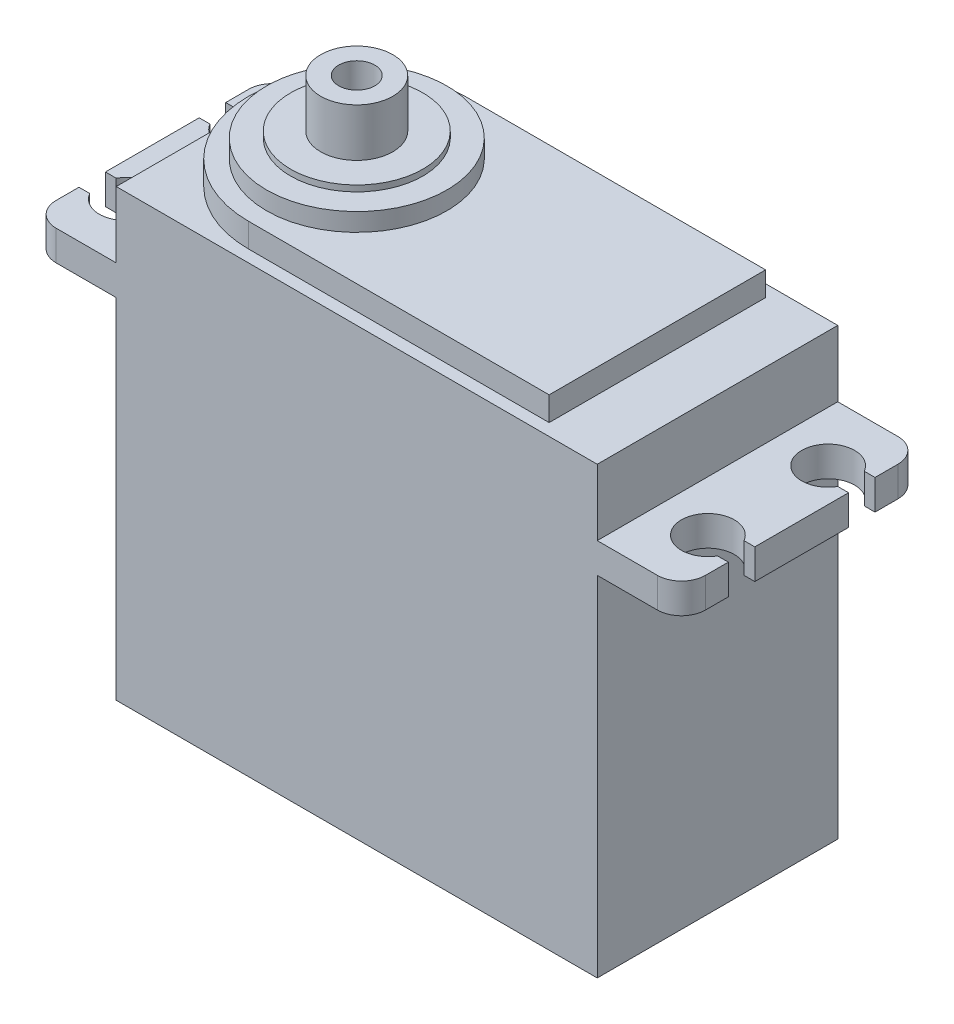
from build123d import *

# Parameters (mm, degrees)
SKETCH_1_W          = 40
SKETCH_1_H          = 20
EXTRUDE_1_DEPTH     = 37
SKETCH_2_W          = 54
SKETCH_2_H          = 20
EXTRUDE_2_DEPTH     = 2.5
SKETCH_3_R          = 2.2
CUT_EXTRUDE_1_DEPTH = 2.5
SKETCH_5_W          = 1.5
SKETCH_5_H          = 2.2
CUT_EXTRUDE_2_DEPTH = 2.5
FILLET_1_R          = 2
EXTRUDE_3_DEPTH     = 2
SKETCH_7_R          = 7.5
EXTRUDE_4_DEPTH     = 1.5
SKETCH_8_R          = 5.5
EXTRUDE_5_DEPTH     = 0.5
SKETCH_9_R          = 3
EXTRUDE_6_DEPTH     = 4
SKETCH_10_R         = 1.5
CUT_EXTRUDE_3_DEPTH = 5


with BuildPart() as part:
    # 草图1 → 凸台-拉伸1 (new body)
    with BuildSketch(Plane(origin=(0, 0, 0), x_dir=(1, 0, 0), z_dir=(0, 1, 0))):
        Rectangle(SKETCH_1_W, SKETCH_1_H)
    extrude(amount=EXTRUDE_1_DEPTH)

    # 草图2 → 凸台-拉伸2 (add)
    with BuildSketch(Plane(origin=(0, 29, 0), x_dir=(-1, 0, 0), z_dir=(0, -1, 0))):
        Rectangle(SKETCH_2_W, SKETCH_2_H)
    extrude(amount=-EXTRUDE_2_DEPTH)

    # 草图3 → 切除-拉伸1 (cut)
    with BuildSketch(Plane(origin=(0, 29, 0), x_dir=(-1, 0, 0), z_dir=(0, -1, 0))):
        with Locations(Location((24.2, 5, 0), (0, 0, 90))):
            Circle(SKETCH_3_R)
        with Locations(Location((-24.2, 5, 0), (0, 0, 90))):
            Circle(SKETCH_3_R)
        with Locations(Location((24.2, -5, 0), (0, 0, 90))):
            Circle(SKETCH_3_R)
        with Locations(Location((-24.2, -5, 0), (0, 0, 90))):
            Circle(SKETCH_3_R)
    extrude(amount=-CUT_EXTRUDE_1_DEPTH, mode=Mode.SUBTRACT)

    # 草图5 → 切除-拉伸2 (cut)
    with BuildSketch(Plane(origin=(0, 29, 0), x_dir=(-1, 0, 0), z_dir=(0, -1, 0))):
        with Locations((-26.25, 5)):
            Rectangle(SKETCH_5_W, SKETCH_5_H)
        with Locations((26.25, 5)):
            Rectangle(SKETCH_5_W, SKETCH_5_H)
        with Locations((26.25, -5)):
            Rectangle(SKETCH_5_W, SKETCH_5_H)
        with Locations((-26.25, -5)):
            Rectangle(SKETCH_5_W, SKETCH_5_H)
    extrude(amount=-CUT_EXTRUDE_2_DEPTH, mode=Mode.SUBTRACT)

    # 圆角1
    fillet_1_edges = [part.edges().sort_by_distance(p)[0] for p in [
        (27, 30.25, -10),
        (-27, 30.25, 10),
        (27, 30.25, 10),
        (-27, 30.25, -10),
    ]]
    fillet(fillet_1_edges, radius=FILLET_1_R)

    # 草图6 → 凸台-拉伸3 (add)
    with BuildSketch(Plane(origin=(0, 37, 0), x_dir=(1, 0, 0), z_dir=(0, 1, 0))):
        with BuildLine():
            Line((-10, 9), (15, 9))
            Line((15, 9), (15, -9))
            Line((15, -9), (-10, -9))
            ThreePointArc((-10, -9), (-19, 0), (-10, 9))
        make_face()
    extrude(amount=EXTRUDE_3_DEPTH)

    # 草图7 → 凸台-拉伸4 (add)
    with BuildSketch(Plane(origin=(0, 39, 0), x_dir=(1, 0, 0), z_dir=(0, 1, 0))):
        with Locations(Location((-10, 0, 0), (0, 0, 270))):
            Circle(SKETCH_7_R)
    extrude(amount=EXTRUDE_4_DEPTH)

    # 草图8 → 凸台-拉伸5 (add)
    with BuildSketch(Plane(origin=(0, 40.5, 0), x_dir=(1, 0, 0), z_dir=(0, 1, 0))):
        with Locations(Location((-10, 0, 0), (0, 0, 270))):
            Circle(SKETCH_8_R)
    extrude(amount=EXTRUDE_5_DEPTH)

    # 草图9 → 凸台-拉伸6 (add)
    with BuildSketch(Plane(origin=(0, 41, 0), x_dir=(1, 0, 0), z_dir=(0, 1, 0))):
        with Locations(Location((-10, 0, 0), (0, 0, 270))):
            Circle(SKETCH_9_R)
    extrude(amount=EXTRUDE_6_DEPTH)

    # 草图10 → 切除-拉伸3 (cut)
    with BuildSketch(Plane(origin=(0, 45, 0), x_dir=(1, 0, 0), z_dir=(0, 1, 0))):
        with Locations(Location((-10, 0, 0), (0, 0, 270))):
            Circle(SKETCH_10_R)
    extrude(amount=-CUT_EXTRUDE_3_DEPTH, mode=Mode.SUBTRACT)


solid = part.part
